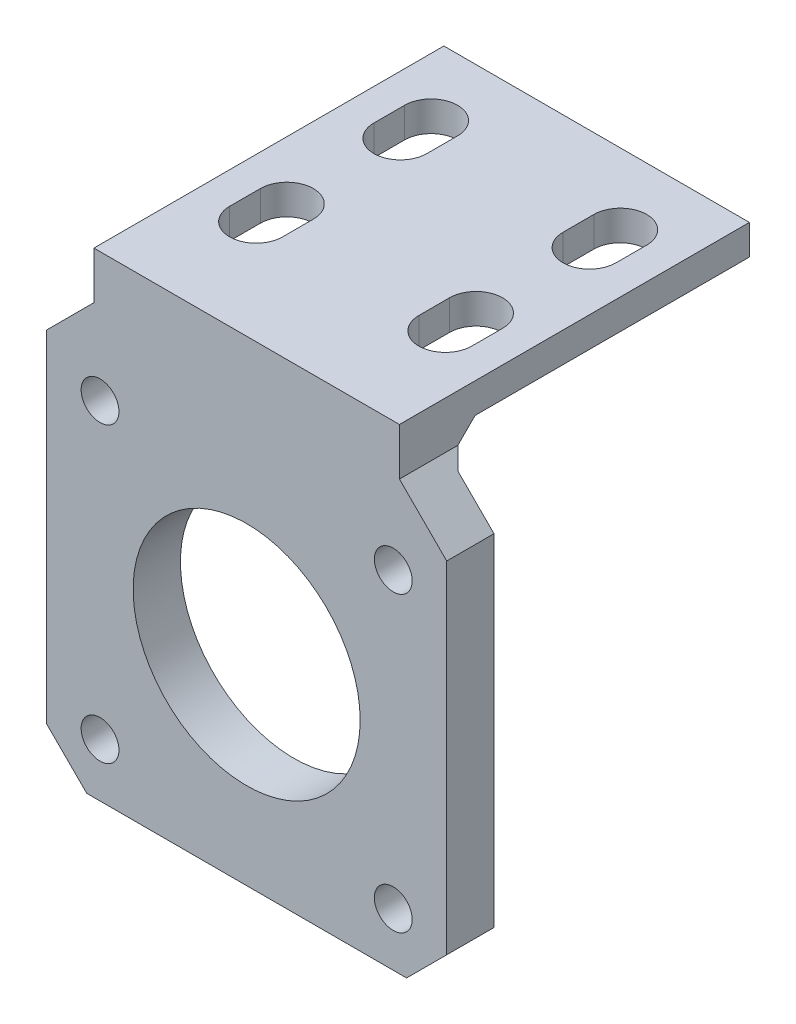
from build123d import *

# Parameters (mm, degrees)
SKETCH1_R           = 2
SKETCH1_R_2         = 12
BOSS_EXTRUDE1_DEPTH = 5
SKETCH2_W           = 32.3
SKETCH2_H           = 3.175
BOSS_EXTRUDE2_DEPTH = 32
CHAMFER1_SIZE       = 3
CUT_EXTRUDE1_DEPTH  = 10
CUT_EXTRUDE2_DEPTH  = 10
BOSS_EXTRUDE3_REACH = 53.634
SKETCH5_W           = 9.21920545
SKETCH5_H           = 4.68574677


with BuildPart() as part:
    # Sketch1 → Boss-Extrude1 (new body)
    with BuildSketch(Plane.XY):
        Polygon((-21.15, -16.907359313), (-21.15, 24.149999999), (-16.15, 24.149999999), (-16.15, 29.149999999), (16.15, 29.149999999), (16.15, 24.149999999), (21.15, 24.149999999), (21.15, -16.907359313), (16.907359313, -21.15), (-16.907359313, -21.15), align=None)
        with Locations((-15.5, 15.5)):
            Circle(SKETCH1_R, mode=Mode.SUBTRACT)
        with Locations((-15.5, -15.5)):
            Circle(SKETCH1_R, mode=Mode.SUBTRACT)
        Circle(SKETCH1_R_2, mode=Mode.SUBTRACT)
        with Locations((15.5, -15.5)):
            Circle(SKETCH1_R, mode=Mode.SUBTRACT)
        with Locations((15.5, 15.5)):
            Circle(SKETCH1_R, mode=Mode.SUBTRACT)
    extrude(amount=BOSS_EXTRUDE1_DEPTH)

    # Sketch2 → Boss-Extrude2 (add)
    with BuildSketch(Plane(origin=(0, 0, 0), x_dir=(-1, 0, 0), z_dir=(0, 0, -1))):
        with Locations((0, 27.562499999)):
            Rectangle(SKETCH2_W, SKETCH2_H)
    extrude(amount=BOSS_EXTRUDE2_DEPTH)

    # Chamfer1
    chamfer1_edges = [part.edges().sort_by_distance(p)[0] for p in [
        (0, 25.974999999, 0),
    ]]
    chamfer(chamfer1_edges, length=CHAMFER1_SIZE)

    # Sketch3 → Cut-Extrude1 (cut)
    with BuildSketch(Plane.XZ.offset(-25.974999999)):
        with BuildLine():
            Line((7.2, -9.25), (7.2, -6))
            ThreePointArc((7.2, -6), (10, -3.2), (12.8, -6))
            Line((12.8, -6), (12.8, -9.25))
            ThreePointArc((12.8, -9.25), (10, -12.05), (7.2, -9.25))
        make_face()
        with BuildLine():
            Line((-12.799999999, -9.25), (-12.799999999, -6))
            ThreePointArc((-12.799999999, -6), (-9.999999999, -3.2), (-7.199999999, -6))
            Line((-7.199999999, -6), (-7.199999999, -9.25))
            ThreePointArc((-7.199999999, -9.25), (-9.999999999, -12.05), (-12.799999999, -9.25))
        make_face()
        with BuildLine():
            Line((12.8, -21.25), (12.8, -24.5))
            ThreePointArc((12.8, -24.5), (10, -27.3), (7.2, -24.5))
            Line((7.2, -24.5), (7.2, -21.25))
            ThreePointArc((7.2, -21.25), (10, -18.45), (12.8, -21.25))
        make_face()
        with BuildLine():
            Line((-7.199999999, -21.25), (-7.199999999, -24.5))
            ThreePointArc((-7.199999999, -24.5), (-9.999999999, -27.3), (-12.799999999, -24.5))
            Line((-12.799999999, -24.5), (-12.799999999, -21.25))
            ThreePointArc((-12.799999999, -21.25), (-9.999999999, -18.45), (-7.199999999, -21.25))
        make_face()
    extrude(amount=-CUT_EXTRUDE1_DEPTH, mode=Mode.SUBTRACT)

    # Sketch4 → Cut-Extrude2 (cut)
    with BuildSketch(Plane.XY.offset(5)):
        Polygon((16.15, 24.149999999), (21.15, 19.149999999), (21.15, 24.149999999), align=None)
        Polygon((-21.15, 24.149999999), (-16.15, 24.149999999), (-21.15, 19.149999999), align=None)
    extrude(amount=-CUT_EXTRUDE2_DEPTH, mode=Mode.SUBTRACT)

    # Boss-Extrude3: up to this plane
    boss_extrude3_end = Plane(origin=(-16.15, 25.974999999, -3), z_dir=(0, -0.7071067811865506, -0.7071067811865445))
    # Sketch5 → Boss-Extrude3 (add, up to the surface)
    with BuildSketch(Plane(origin=(0, 0, -32), x_dir=(-1, 0, 0), z_dir=(0, 0, -1)), mode=Mode.PRIVATE) as boss_extrude3_sk1:
        with Locations((0, 25.974999999)):
            Rectangle(SKETCH5_W, SKETCH5_H)
    boss_extrude3_tool1 = split(extrude(boss_extrude3_sk1.sketch, amount=-BOSS_EXTRUDE3_REACH, mode=Mode.PRIVATE), bisect_by=boss_extrude3_end, keep=Keep.BOTH, mode=Mode.PRIVATE)
    add(boss_extrude3_tool1.solids().sort_by_distance((0, 25.975, -32))[0])


solid = part.part
